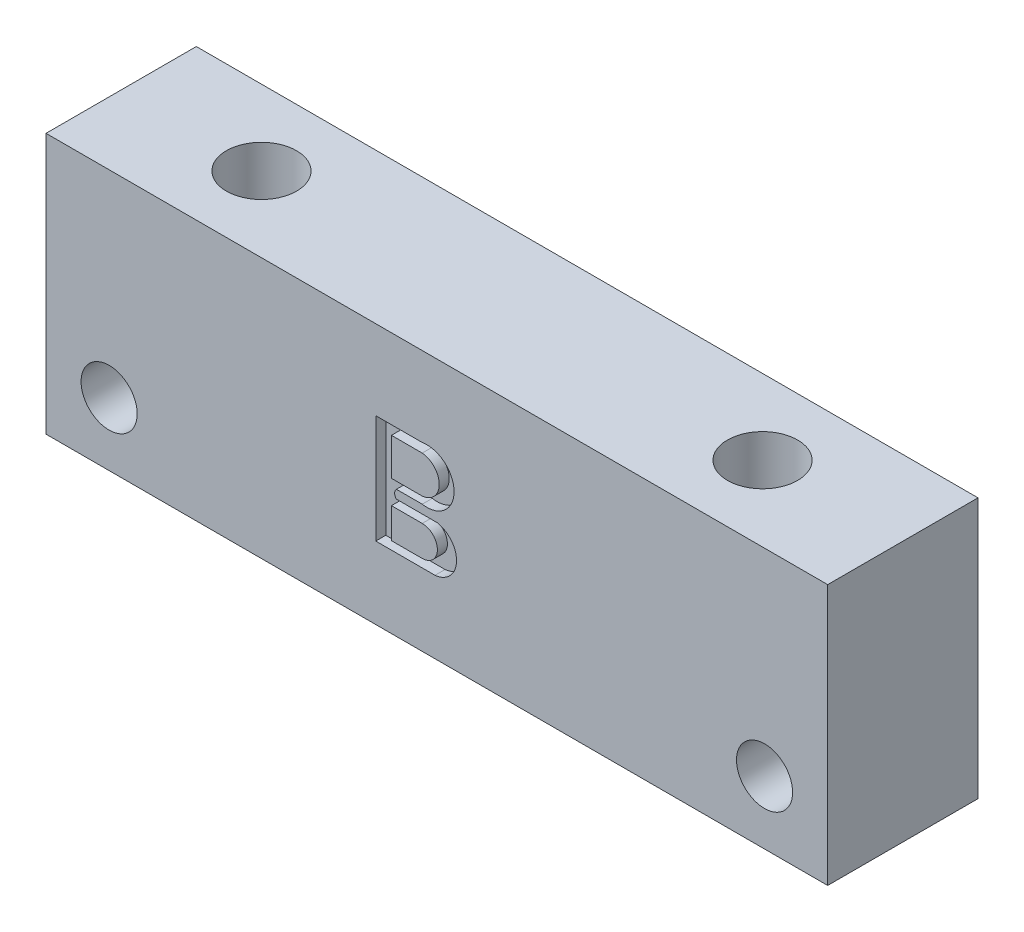
from build123d import *

# Parameters (mm, degrees)
SKETCH1_W           = 39
SKETCH1_H           = 13
SKETCH1_R           = 1.4
BOSS_EXTRUDE2_DEPTH = 7.5
SKETCH2_R           = 1.75
CUT_EXTRUDE1_DEPTH  = 26.615367173
CUT_EXTRUDE2_DEPTH  = 0.5


with BuildPart() as part:
    # Sketch1 → Boss-Extrude2 (new body)
    with BuildSketch(Plane.XY):
        with Locations((1.258059529, -6.888438134)):
            Rectangle(SKETCH1_W, SKETCH1_H)
        with Locations((-15.091940471, -10.238438134)):
            Circle(SKETCH1_R, mode=Mode.SUBTRACT)
        with Locations((17.608059529, -10.238438134)):
            Circle(SKETCH1_R, mode=Mode.SUBTRACT)
    extrude(amount=-BOSS_EXTRUDE2_DEPTH)

    # Sketch2 → Cut-Extrude1 (cut, through all)
    with BuildSketch(Plane(origin=(0, -0.388438134, 0), x_dir=(1, 0, 0), z_dir=(0, 1, 0))):
        with Locations(Location((-11.241940471, 3.75, 0), (0, 0, 180))):
            Circle(SKETCH2_R)
        with Locations(Location((13.758059529, 3.75, 0), (0, 0, 180))):
            Circle(SKETCH2_R)
    extrude(amount=-CUT_EXTRUDE1_DEPTH, mode=Mode.SUBTRACT)

    # Sketch3 → Cut-Extrude2 (cut)
    with BuildSketch(Plane.XY):
        with BuildLine():
            Line((-1.789484561, -4.361984997), (0.528429434, -4.361984997))
            ThreePointArc((0.528429434, -4.361984997), (2.118216576, -5.694764696), (0.528429434, -7.027544395))
            Line((0.528429434, -7.027544395), (-0.758815547, -7.027544395))
            ThreePointArc((-0.758815547, -7.027544395), (-0.847047418, -7.240554977), (-0.758815547, -7.453565558))
            Line((-0.758815547, -7.453565558), (1.285636155, -7.453565558))
            ThreePointArc((1.285636155, -7.453565558), (2.238737943, -8.66797631), (1.168769854, -9.780794705))
            Line((1.168769854, -9.780794705), (-1.789484561, -9.780794705))
            Line((-1.789484561, -9.780794705), (-1.789484561, -4.361984997))
        make_face()
        with BuildLine():
            Line((-1.006496381, -4.819305585), (-1.006496381, -6.678234448))
            Line((-1.006496381, -6.678234448), (0.528429434, -6.678234448))
            ThreePointArc((0.528429434, -6.678234448), (1.377263921, -5.748770016), (0.528429434, -4.819305585))
            Line((0.528429434, -4.819305585), (-1.006496381, -4.819305585))
        make_face(mode=Mode.SUBTRACT)
        with BuildLine():
            Line((-1.006496381, -7.858595879), (-1.006496381, -9.373009321))
            Line((-1.006496381, -9.373009321), (0.528429434, -9.373009321))
            ThreePointArc((0.528429434, -9.373009321), (1.285636155, -8.6158026), (0.528429434, -7.858595879))
            Line((0.528429434, -7.858595879), (-1.006496381, -7.858595879))
        make_face(mode=Mode.SUBTRACT)
    extrude(amount=-CUT_EXTRUDE2_DEPTH, mode=Mode.SUBTRACT)


solid = part.part
